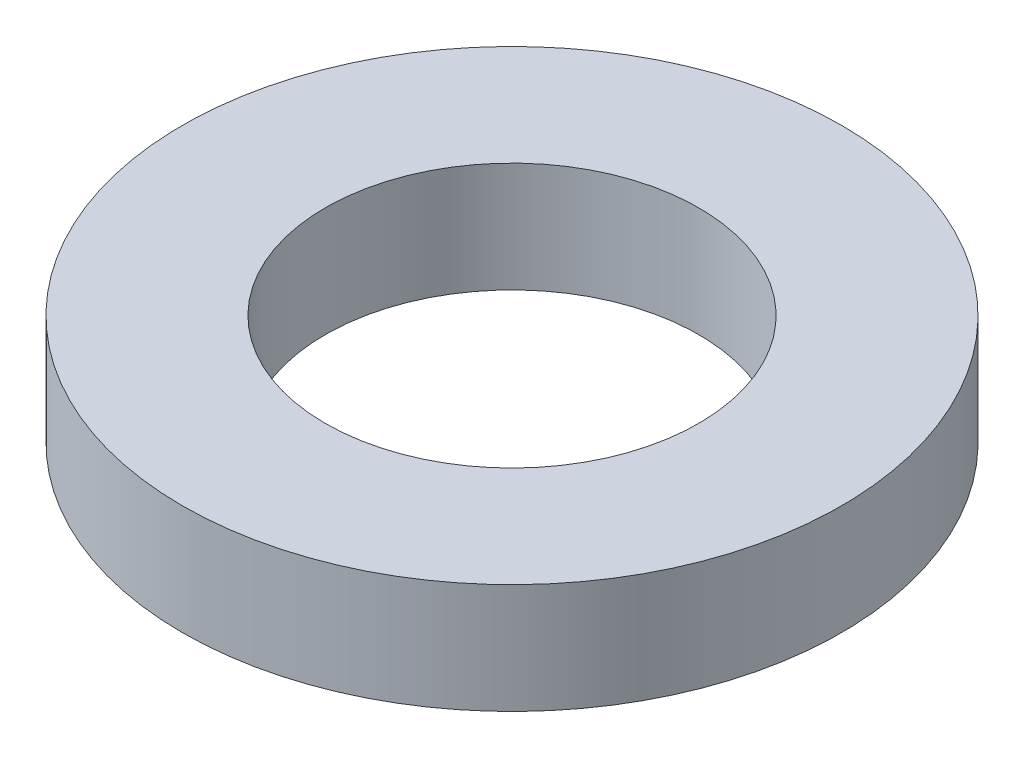
from build123d import *

# Parameters (mm, degrees)
SKETCH1_R           = 4.5
SKETCH1_R_2         = 2.55
BOSS_EXTRUDE1_DEPTH = 1.5


with BuildPart() as part:
    # Sketch1 → Boss-Extrude1 (new body)
    with BuildSketch(Plane(origin=(0, 0, 0), x_dir=(1, 0, 0), z_dir=(0, 1, 0))):
        with Locations(Location((0, 0, 0), (0, 0, 270))):
            Circle(SKETCH1_R)
        with Locations(Location((0, 0, 0), (0, 0, 270))):
            Circle(SKETCH1_R_2, mode=Mode.SUBTRACT)
    extrude(amount=BOSS_EXTRUDE1_DEPTH)


solid = part.part
